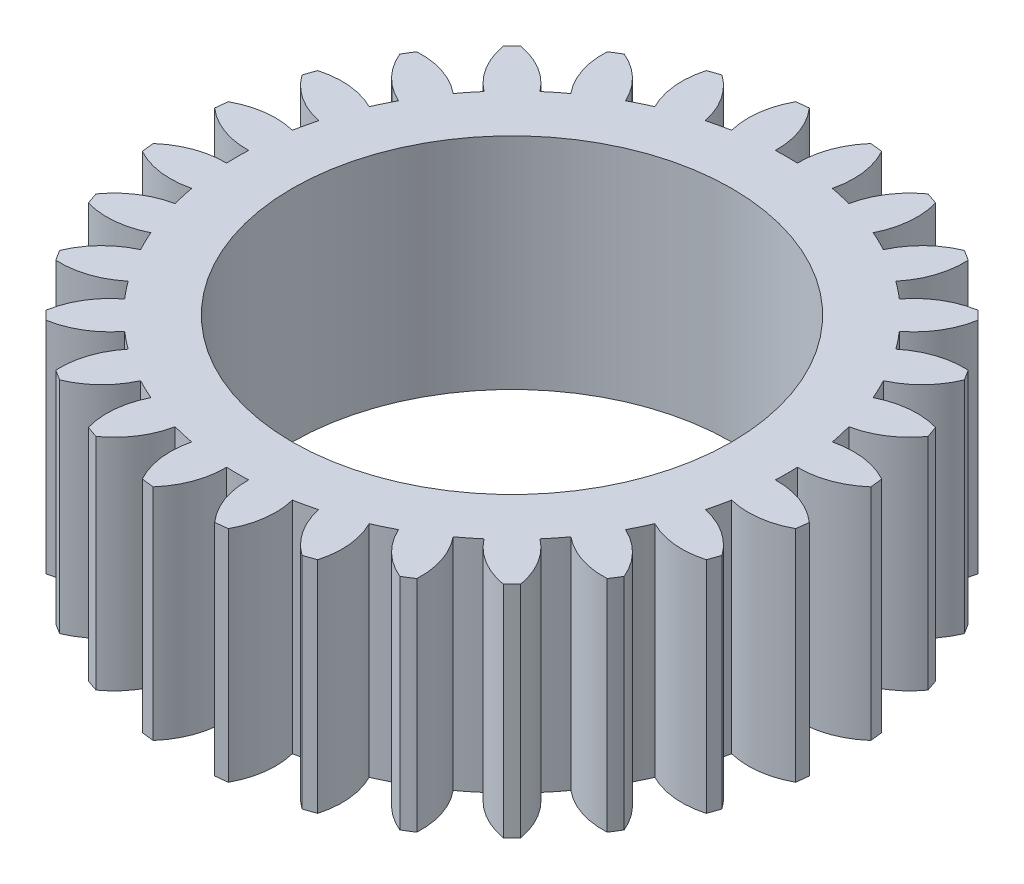
from build123d import *

# Parameters (mm, degrees)
SKETCH1_R           = 1
BOSS_EXTRUDE1_DEPTH = 1


with BuildPart() as part:
    # Sketch1 → Boss-Extrude1 (new body)
    with BuildSketch(Plane(origin=(0, 0, 0), x_dir=(1, 0, 0), z_dir=(0, 1, 0))):
        with BuildLine():
            ThreePointArc((0.19583451, 1.487161338), (0.167946714, 1.490568315), (0.14, 1.493452376))
            ThreePointArc((0.14, 1.493452376), (0.071938149, 1.379716653), (0.05, 1.2489996))
            ThreePointArc((0.05, 1.2489996), (0, 1.25), (-0.05, 1.2489996))
            ThreePointArc((-0.05, 1.2489996), (-0.071938149, 1.379716653), (-0.14, 1.493452376))
            ThreePointArc((-0.14, 1.493452376), (-0.167946714, 1.490568315), (-0.19583451, 1.487161338))
            ThreePointArc((-0.19583451, 1.487161338), (-0.236881329, 1.36113202), (-0.229182162, 1.228810619))
            ThreePointArc((-0.229182162, 1.228810619), (-0.278151167, 1.21865989), (-0.326674953, 1.206558525))
            ThreePointArc((-0.326674953, 1.206558525), (-0.377150347, 1.329116532), (-0.468814325, 1.424855476))
            ThreePointArc((-0.468814325, 1.424855476), (-0.495418593, 1.415824995), (-0.52184906, 1.40629782))
            ThreePointArc((-0.52184906, 1.40629782), (-0.533822588, 1.274294544), (-0.496872173, 1.147003942))
            ThreePointArc((-0.496872173, 1.147003942), (-0.542354674, 1.126211085), (-0.58696906, 1.103615568))
            ThreePointArc((-0.58696906, 1.103615568), (-0.663450653, 1.211868958), (-0.774120343, 1.284810373))
            ThreePointArc((-0.774120343, 1.284810373), (-0.798048115, 1.270086299), (-0.821695919, 1.254916658))
            ThreePointArc((-0.821695919, 1.254916658), (-0.803995753, 1.123558618), (-0.739646939, 1.007681699))
            ThreePointArc((-0.739646939, 1.007681699), (-0.779362252, 0.977289353), (-0.817830087, 0.945332719))
            ThreePointArc((-0.817830087, 0.945332719), (-0.916482772, 1.033853214), (-1.040608734, 1.080339513))
            ThreePointArc((-1.040608734, 1.080339513), (-1.060660172, 1.060660172), (-1.080339513, 1.040608734))
            ThreePointArc((-1.080339513, 1.040608734), (-1.033853214, 0.916482772), (-0.945332719, 0.817830087))
            ThreePointArc((-0.945332719, 0.817830087), (-0.977289353, 0.779362252), (-1.007681699, 0.739646939))
            ThreePointArc((-1.007681699, 0.739646939), (-1.123558618, 0.803995753), (-1.254916658, 0.821695919))
            ThreePointArc((-1.254916658, 0.821695919), (-1.270086299, 0.798048115), (-1.284810373, 0.774120343))
            ThreePointArc((-1.284810373, 0.774120343), (-1.211868958, 0.663450653), (-1.103615568, 0.58696906))
            ThreePointArc((-1.103615568, 0.58696906), (-1.126211085, 0.542354674), (-1.147003942, 0.496872173))
            ThreePointArc((-1.147003942, 0.496872173), (-1.274294544, 0.533822588), (-1.40629782, 0.52184906))
            ThreePointArc((-1.40629782, 0.52184906), (-1.415824995, 0.495418593), (-1.424855476, 0.468814325))
            ThreePointArc((-1.424855476, 0.468814325), (-1.329116532, 0.377150347), (-1.206558525, 0.326674953))
            ThreePointArc((-1.206558525, 0.326674953), (-1.21865989, 0.278151167), (-1.228810619, 0.229182162))
            ThreePointArc((-1.228810619, 0.229182162), (-1.36113202, 0.236881329), (-1.487161338, 0.19583451))
            ThreePointArc((-1.487161338, 0.19583451), (-1.490568315, 0.167946714), (-1.493452376, 0.14))
            ThreePointArc((-1.493452376, 0.14), (-1.379716653, 0.071938149), (-1.2489996, 0.05))
            ThreePointArc((-1.2489996, 0.05), (-1.25, 0), (-1.2489996, -0.05))
            ThreePointArc((-1.2489996, -0.05), (-1.379716653, -0.071938149), (-1.493452376, -0.14))
            ThreePointArc((-1.493452376, -0.14), (-1.490568315, -0.167946714), (-1.487161338, -0.19583451))
            ThreePointArc((-1.487161338, -0.19583451), (-1.36113202, -0.236881329), (-1.228810619, -0.229182162))
            ThreePointArc((-1.228810619, -0.229182162), (-1.21865989, -0.278151167), (-1.206558525, -0.326674953))
            ThreePointArc((-1.206558525, -0.326674953), (-1.329116532, -0.377150347), (-1.424855476, -0.468814325))
            ThreePointArc((-1.424855476, -0.468814325), (-1.415824995, -0.495418593), (-1.40629782, -0.52184906))
            ThreePointArc((-1.40629782, -0.52184906), (-1.274294544, -0.533822588), (-1.147003942, -0.496872173))
            ThreePointArc((-1.147003942, -0.496872173), (-1.126211085, -0.542354674), (-1.103615568, -0.58696906))
            ThreePointArc((-1.103615568, -0.58696906), (-1.211868958, -0.663450653), (-1.284810373, -0.774120343))
            ThreePointArc((-1.284810373, -0.774120343), (-1.270086299, -0.798048115), (-1.254916658, -0.821695919))
            ThreePointArc((-1.254916658, -0.821695919), (-1.123558618, -0.803995753), (-1.007681699, -0.739646939))
            ThreePointArc((-1.007681699, -0.739646939), (-0.977289353, -0.779362252), (-0.945332719, -0.817830087))
            ThreePointArc((-0.945332719, -0.817830087), (-1.033853214, -0.916482772), (-1.080339513, -1.040608734))
            ThreePointArc((-1.080339513, -1.040608734), (-1.060660172, -1.060660172), (-1.040608734, -1.080339513))
            ThreePointArc((-1.040608734, -1.080339513), (-0.916482772, -1.033853214), (-0.817830087, -0.945332719))
            ThreePointArc((-0.817830087, -0.945332719), (-0.779362252, -0.977289353), (-0.739646939, -1.007681699))
            ThreePointArc((-0.739646939, -1.007681699), (-0.803995753, -1.123558618), (-0.821695919, -1.254916658))
            ThreePointArc((-0.821695919, -1.254916658), (-0.798048115, -1.270086299), (-0.774120343, -1.284810373))
            ThreePointArc((-0.774120343, -1.284810373), (-0.663450653, -1.211868958), (-0.58696906, -1.103615568))
            ThreePointArc((-0.58696906, -1.103615568), (-0.542354674, -1.126211085), (-0.496872173, -1.147003942))
            ThreePointArc((-0.496872173, -1.147003942), (-0.533822588, -1.274294544), (-0.52184906, -1.40629782))
            ThreePointArc((-0.52184906, -1.40629782), (-0.495418593, -1.415824995), (-0.468814325, -1.424855476))
            ThreePointArc((-0.468814325, -1.424855476), (-0.377150347, -1.329116532), (-0.326674953, -1.206558525))
            ThreePointArc((-0.326674953, -1.206558525), (-0.278151167, -1.21865989), (-0.229182162, -1.228810619))
            ThreePointArc((-0.229182162, -1.228810619), (-0.236881329, -1.36113202), (-0.19583451, -1.487161338))
            ThreePointArc((-0.19583451, -1.487161338), (-0.167946714, -1.490568315), (-0.14, -1.493452376))
            ThreePointArc((-0.14, -1.493452376), (-0.071938149, -1.379716653), (-0.05, -1.2489996))
            ThreePointArc((-0.05, -1.2489996), (0, -1.25), (0.05, -1.2489996))
            ThreePointArc((0.05, -1.2489996), (0.071938149, -1.379716653), (0.14, -1.493452376))
            ThreePointArc((0.14, -1.493452376), (0.167946714, -1.490568315), (0.19583451, -1.487161338))
            ThreePointArc((0.19583451, -1.487161338), (0.236881329, -1.36113202), (0.229182162, -1.228810619))
            ThreePointArc((0.229182162, -1.228810619), (0.278151167, -1.21865989), (0.326674953, -1.206558525))
            ThreePointArc((0.326674953, -1.206558525), (0.377150347, -1.329116532), (0.468814325, -1.424855476))
            ThreePointArc((0.468814325, -1.424855476), (0.495418593, -1.415824995), (0.52184906, -1.40629782))
            ThreePointArc((0.52184906, -1.40629782), (0.533822588, -1.274294544), (0.496872173, -1.147003942))
            ThreePointArc((0.496872173, -1.147003942), (0.542354674, -1.126211085), (0.58696906, -1.103615568))
            ThreePointArc((0.58696906, -1.103615568), (0.663450653, -1.211868958), (0.774120343, -1.284810373))
            ThreePointArc((0.774120343, -1.284810373), (0.798048115, -1.270086299), (0.821695919, -1.254916658))
            ThreePointArc((0.821695919, -1.254916658), (0.803995753, -1.123558618), (0.739646939, -1.007681699))
            ThreePointArc((0.739646939, -1.007681699), (0.779362252, -0.977289353), (0.817830087, -0.945332719))
            ThreePointArc((0.817830087, -0.945332719), (0.916482772, -1.033853214), (1.040608734, -1.080339513))
            ThreePointArc((1.040608734, -1.080339513), (1.060660172, -1.060660172), (1.080339513, -1.040608734))
            ThreePointArc((1.080339513, -1.040608734), (1.033853214, -0.916482772), (0.945332719, -0.817830087))
            ThreePointArc((0.945332719, -0.817830087), (0.977289353, -0.779362252), (1.007681699, -0.739646939))
            ThreePointArc((1.007681699, -0.739646939), (1.123558618, -0.803995753), (1.254916658, -0.821695919))
            ThreePointArc((1.254916658, -0.821695919), (1.270086299, -0.798048115), (1.284810373, -0.774120343))
            ThreePointArc((1.284810373, -0.774120343), (1.211868958, -0.663450653), (1.103615568, -0.58696906))
            ThreePointArc((1.103615568, -0.58696906), (1.126211085, -0.542354674), (1.147003942, -0.496872173))
            ThreePointArc((1.147003942, -0.496872173), (1.274294544, -0.533822588), (1.40629782, -0.52184906))
            ThreePointArc((1.40629782, -0.52184906), (1.415824995, -0.495418593), (1.424855476, -0.468814325))
            ThreePointArc((1.424855476, -0.468814325), (1.329116532, -0.377150347), (1.206558525, -0.326674953))
            ThreePointArc((1.206558525, -0.326674953), (1.21865989, -0.278151167), (1.228810619, -0.229182162))
            ThreePointArc((1.228810619, -0.229182162), (1.36113202, -0.236881329), (1.487161338, -0.19583451))
            ThreePointArc((1.487161338, -0.19583451), (1.490568315, -0.167946714), (1.493452376, -0.14))
            ThreePointArc((1.493452376, -0.14), (1.379716653, -0.071938149), (1.2489996, -0.05))
            ThreePointArc((1.2489996, -0.05), (1.25, 0), (1.2489996, 0.05))
            ThreePointArc((1.2489996, 0.05), (1.379716653, 0.071938149), (1.493452376, 0.14))
            ThreePointArc((1.493452376, 0.14), (1.490568315, 0.167946714), (1.487161338, 0.19583451))
            ThreePointArc((1.487161338, 0.19583451), (1.36113202, 0.236881329), (1.228810619, 0.229182162))
            ThreePointArc((1.228810619, 0.229182162), (1.21865989, 0.278151167), (1.206558525, 0.326674953))
            ThreePointArc((1.206558525, 0.326674953), (1.329116532, 0.377150347), (1.424855476, 0.468814325))
            ThreePointArc((1.424855476, 0.468814325), (1.415824995, 0.495418593), (1.40629782, 0.52184906))
            ThreePointArc((1.40629782, 0.52184906), (1.274294544, 0.533822588), (1.147003942, 0.496872173))
            ThreePointArc((1.147003942, 0.496872173), (1.126211085, 0.542354674), (1.103615568, 0.58696906))
            ThreePointArc((1.103615568, 0.58696906), (1.211868958, 0.663450653), (1.284810373, 0.774120343))
            ThreePointArc((1.284810373, 0.774120343), (1.270086299, 0.798048115), (1.254916658, 0.821695919))
            ThreePointArc((1.254916658, 0.821695919), (1.123558618, 0.803995753), (1.007681699, 0.739646939))
            ThreePointArc((1.007681699, 0.739646939), (0.977289353, 0.779362252), (0.945332719, 0.817830087))
            ThreePointArc((0.945332719, 0.817830087), (1.033853214, 0.916482772), (1.080339513, 1.040608734))
            ThreePointArc((1.080339513, 1.040608734), (1.060660172, 1.060660172), (1.040608734, 1.080339513))
            ThreePointArc((1.040608734, 1.080339513), (0.916482772, 1.033853214), (0.817830087, 0.945332719))
            ThreePointArc((0.817830087, 0.945332719), (0.779362252, 0.977289353), (0.739646939, 1.007681699))
            ThreePointArc((0.739646939, 1.007681699), (0.803995753, 1.123558618), (0.821695919, 1.254916658))
            ThreePointArc((0.821695919, 1.254916658), (0.798048115, 1.270086299), (0.774120343, 1.284810373))
            ThreePointArc((0.774120343, 1.284810373), (0.663450653, 1.211868958), (0.58696906, 1.103615568))
            ThreePointArc((0.58696906, 1.103615568), (0.542354674, 1.126211085), (0.496872173, 1.147003942))
            ThreePointArc((0.496872173, 1.147003942), (0.533822588, 1.274294544), (0.52184906, 1.40629782))
            ThreePointArc((0.52184906, 1.40629782), (0.495418593, 1.415824995), (0.468814325, 1.424855476))
            ThreePointArc((0.468814325, 1.424855476), (0.377150347, 1.329116532), (0.326674953, 1.206558525))
            ThreePointArc((0.326674953, 1.206558525), (0.278151167, 1.21865989), (0.229182162, 1.228810619))
            ThreePointArc((0.229182162, 1.228810619), (0.236881329, 1.36113202), (0.19583451, 1.487161338))
        make_face()
        with Locations(Location((0, 0, 0), (0, 0, 270))):
            Circle(SKETCH1_R, mode=Mode.SUBTRACT)
    extrude(amount=BOSS_EXTRUDE1_DEPTH)


solid = part.part
